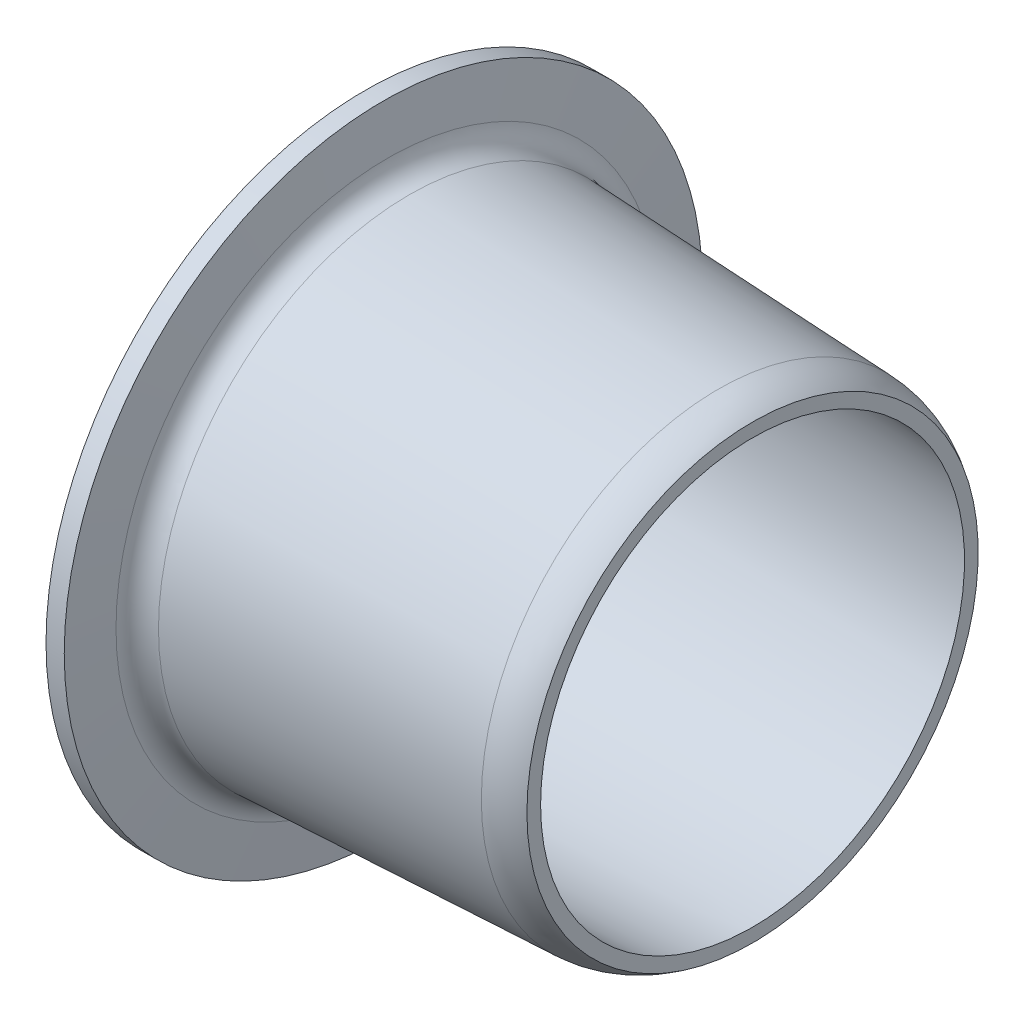
from build123d import *


with BuildPart() as part:
    # Esboço1 → Revolução1 (revolve)
    with BuildSketch(Plane.XY, mode=Mode.PRIVATE) as revolu_o1_sk:
        with BuildLine():
            Line((0, 2.199809904), (0, 2.8))
            Line((0, 2.8), (0.16, 2.8))
            Line((0.16, 2.8), (0.196537584, 2.382373504))
            ThreePointArc((0.196537584, 2.382373504), (0.257432856, 2.255371175), (0.386939067, 2.2))
            Line((0.386939067, 2.2), (3.1, 2.08))
            ThreePointArc((3.1, 2.08), (3.256983611, 2.050950832), (3.4, 1.98))
            Line((3.4, 1.98), (3.4, 1.86))
            Line((3.4, 1.86), (0.191282067, 2))
            ThreePointArc((0.191282067, 2), (0.055529265, 2.061505143), (0, 2.199809904))
        make_face()
    revolve(revolu_o1_sk.sketch.rotate(Axis((0, 0, 0), (1, 0, 0)), 90), axis=Axis((0, 0, 0), (1, 0, 0)))


solid = part.part
